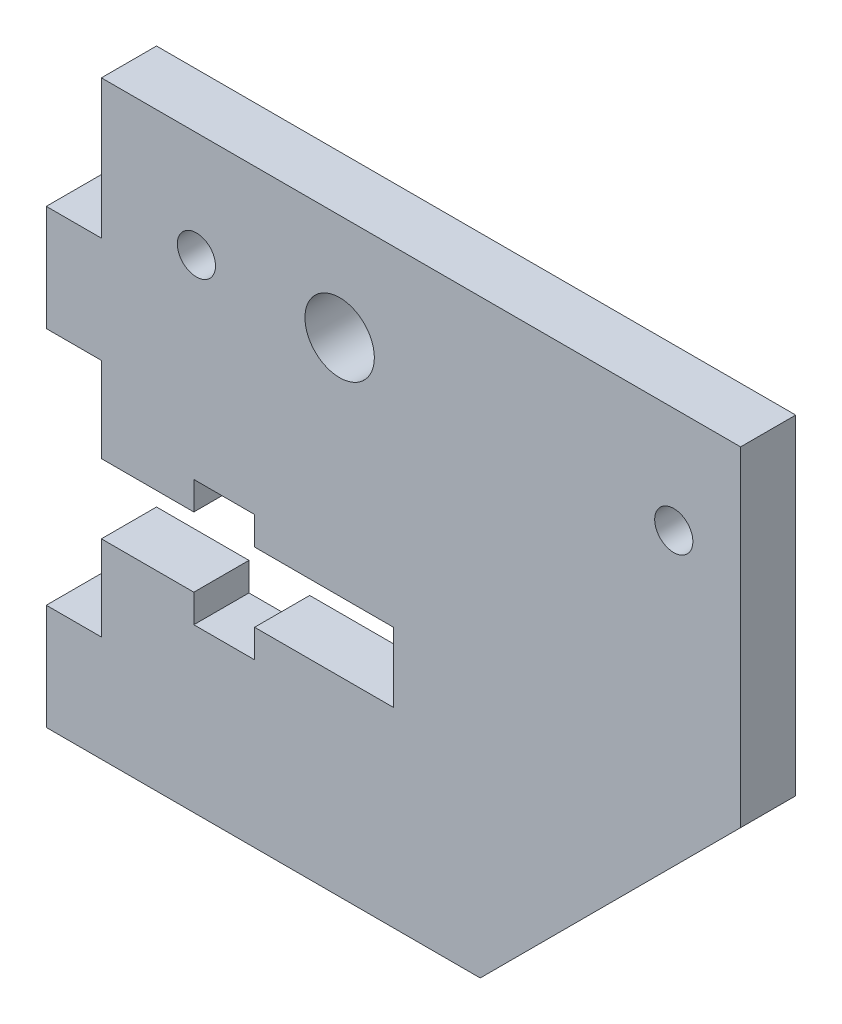
from build123d import *

# Parameters (mm, degrees)
SKETCH1_R           = 1.1
SKETCH1_W           = 23.2
SKETCH1_H           = 12.2
SKETCH1_R_2         = 2
BOSS_EXTRUDE1_DEPTH = 3.175
CHAMFER1_SIZE       = 15


with BuildPart() as part:
    # Sketch1 → Boss-Extrude1 (new body)
    # profile 1 of 3: a face of its own
    with BuildSketch(Plane.XY):
        Polygon((10.8, 21.8), (10.8, 34), (3.175, 34), (3.175, 26), (0, 26), (0, 19.9), (3.175, 19.9), (3.175, 17), (40, 17), (40, 34), (34, 34), (34, 21.8), align=None)
        with Locations((8.65, 27.9)):
            Circle(SKETCH1_R, mode=Mode.SUBTRACT)
        with Locations((36.15, 27.9)):
            Circle(SKETCH1_R, mode=Mode.SUBTRACT)
    # profile 2 of 3: a face of its own
    with BuildSketch(Plane.XY):
        Polygon((40, 0), (40, 17), (3.175, 17), (3.175, 15), (8.5, 15), (8.5, 16.625), (12, 16.625), (12, 15), (20, 15), (20, 11), (12, 11), (12, 9.375), (8.5, 9.375), (8.5, 11), (3.175, 11), (3.175, 6.1), (0, 6.1), (0, 0), align=None)
    # profile 3 of 3: a face of its own
    with BuildSketch(Plane.XY):
        with Locations((22.4, 27.9)):
            Rectangle(SKETCH1_W, SKETCH1_H)
        with Locations((16.9, 27.9)):
            Circle(SKETCH1_R_2, mode=Mode.SUBTRACT)
    extrude(amount=BOSS_EXTRUDE1_DEPTH)

    # Chamfer1
    chamfer1_edges = [part.edges().sort_by_distance(p)[0] for p in [
        (40, 0, 1.5875),
    ]]
    chamfer(chamfer1_edges, length=CHAMFER1_SIZE)


solid = part.part
